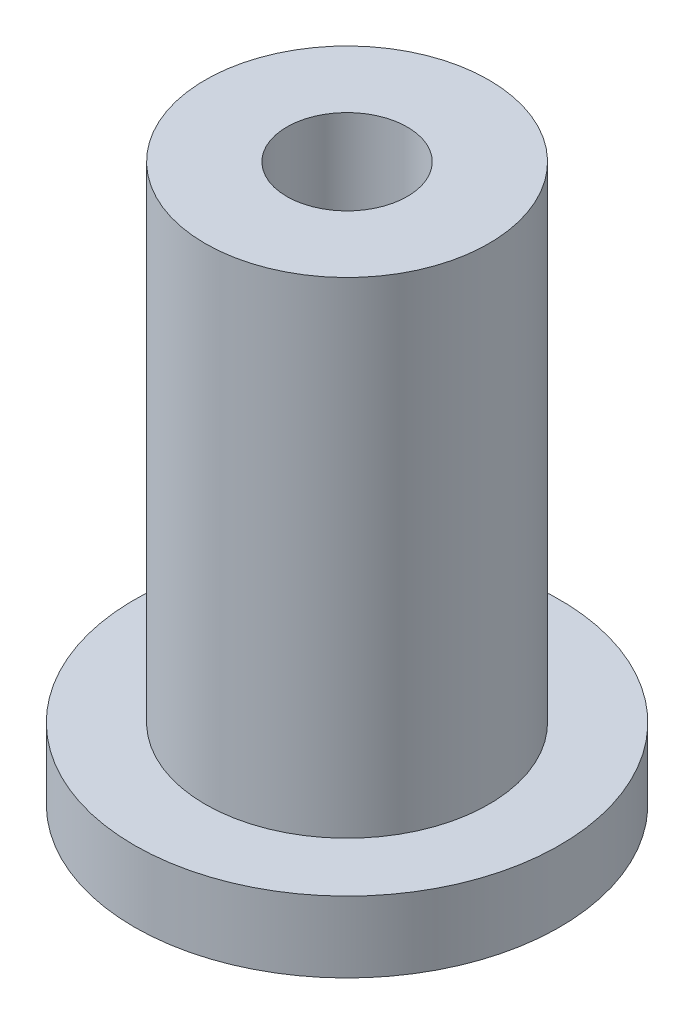
from build123d import *

# Parameters (mm, degrees)
SKETCH1_R           = 6
BOSS_EXTRUDE1_DEPTH = 2
SKETCH2_R           = 4
BOSS_EXTRUDE2_DEPTH = 15.7
SKETCH3_R           = 1.7
CUT_EXTRUDE1_DEPTH  = 344.860877245


with BuildPart() as part:
    # Sketch1 → Boss-Extrude1 (new body)
    with BuildSketch(Plane(origin=(0, -29.3, 0), x_dir=(1, 0, 0), z_dir=(0, 1, 0))):
        with Locations(Location((137.2, -306.23, 0), (0, 0, 270))):
            Circle(SKETCH1_R)
    extrude(amount=BOSS_EXTRUDE1_DEPTH)

    # Sketch2 → Boss-Extrude2 (add)
    with BuildSketch(Plane(origin=(0, -29.3, 0), x_dir=(1, 0, 0), z_dir=(0, 1, 0))):
        with Locations(Location((137.2, -306.23, 0), (0, 0, 270))):
            Circle(SKETCH2_R)
    extrude(amount=BOSS_EXTRUDE2_DEPTH)

    # Sketch3 → Cut-Extrude1 (cut, through all)
    with BuildSketch(Plane(origin=(0, -29.3, 0), x_dir=(1, 0, 0), z_dir=(0, 1, 0))):
        with Locations(Location((137.2, -306.23, 0), (0, 0, 270))):
            Circle(SKETCH3_R)
    extrude(amount=CUT_EXTRUDE1_DEPTH, mode=Mode.SUBTRACT)


solid = part.part
